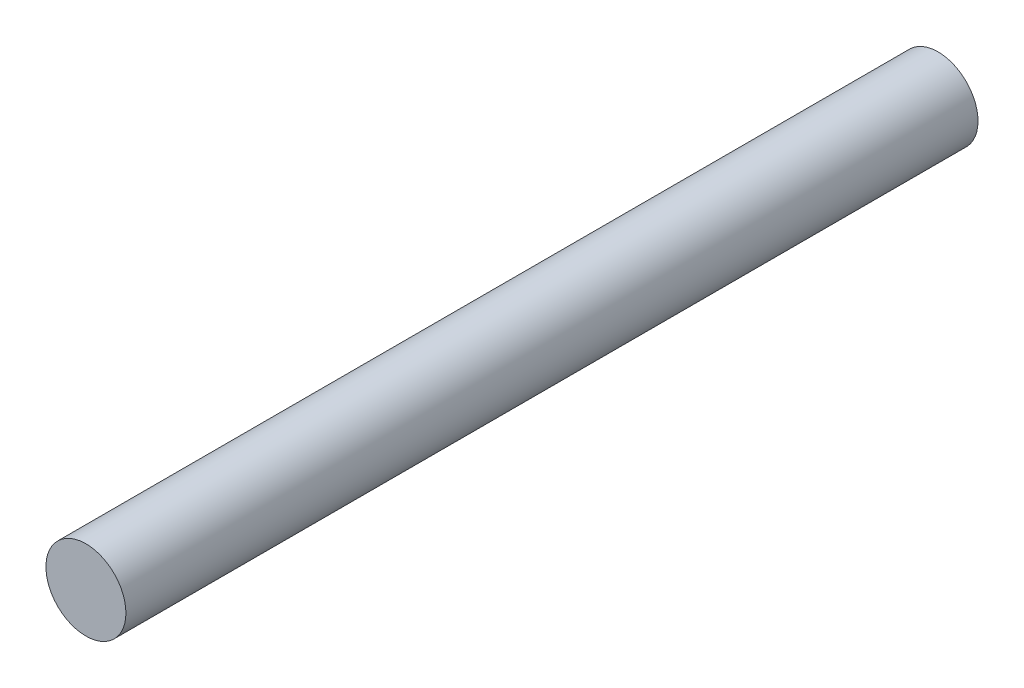
from build123d import *

# Parameters (mm, degrees)
SKETCH1_R           = 4.7625
BOSS_EXTRUDE1_DEPTH = 101.473


with BuildPart() as part:
    # Sketch1 → Boss-Extrude1 (new body)
    with BuildSketch(Plane.XY):
        Circle(SKETCH1_R)
    extrude(amount=BOSS_EXTRUDE1_DEPTH)


solid = part.part
